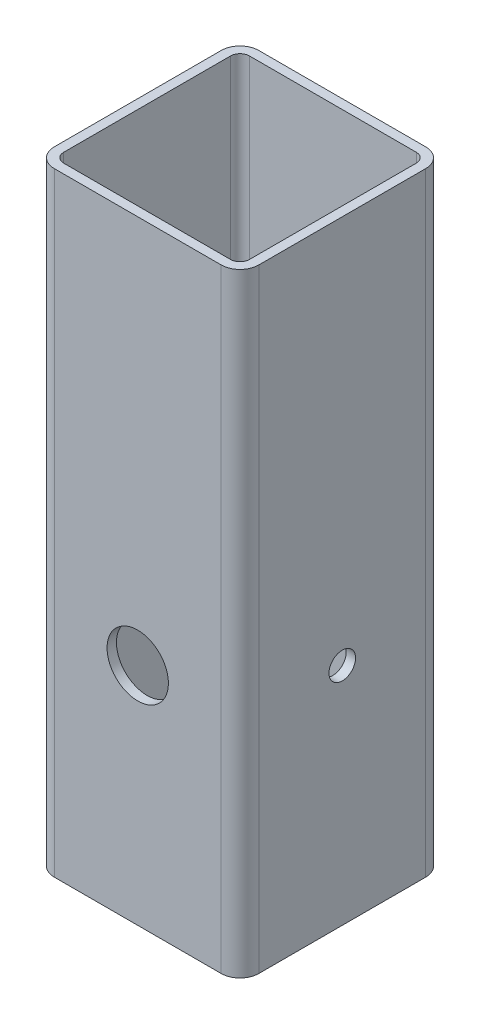
from build123d import *

# Parameters (mm, degrees)
SHS_C450_AS_50X50X2_3_SHS_C450_1_DEPTH = 150
SKETCH12_R                             = 3.25
CUT_EXTRUDE1_DEPTH                     = 10
SKETCH13_R                             = 3.25
CUT_EXTRUDE2_DEPTH                     = 10
SKETCH14_R                             = 7.5
CUT_EXTRUDE3_DEPTH                     = 10
SKETCH15_R                             = 7.5
CUT_EXTRUDE4_DEPTH                     = 10


with BuildPart() as part:
    # Sketch11 → Shs c450 as 50X50X2.3 SHS C450(1) (new body)
    with BuildSketch(Plane.ZX.offset(-75)):
        with BuildLine():
            Line((-20.4, -25), (20.4, -25))
            ThreePointArc((20.4, -25), (23.652691193, -23.652691193), (25, -20.4))
            Line((25, -20.4), (25, 20.4))
            ThreePointArc((25, 20.4), (23.652691193, 23.652691193), (20.4, 25))
            Line((20.4, 25), (-20.4, 25))
            ThreePointArc((-20.4, 25), (-23.652691193, 23.652691193), (-25, 20.4))
            Line((-25, 20.4), (-25, -20.4))
            ThreePointArc((-25, -20.4), (-23.652691193, -23.652691193), (-20.4, -25))
        make_face()
        with BuildLine():
            Line((-20.4, 22.7), (20.4, 22.7))
            ThreePointArc((20.4, 22.7), (22.026345597, 22.026345597), (22.7, 20.4))
            Line((22.7, 20.4), (22.7, -20.4))
            ThreePointArc((22.7, -20.4), (22.026345597, -22.026345597), (20.4, -22.7))
            Line((20.4, -22.7), (-20.4, -22.7))
            ThreePointArc((-20.4, -22.7), (-22.026345597, -22.026345597), (-22.7, -20.4))
            Line((-22.7, -20.4), (-22.7, 20.4))
            ThreePointArc((-22.7, 20.4), (-22.026345597, 22.026345597), (-20.4, 22.7))
        make_face(mode=Mode.SUBTRACT)
    extrude(amount=SHS_C450_AS_50X50X2_3_SHS_C450_1_DEPTH)

    # Sketch12 → Cut-Extrude1 (cut)
    with BuildSketch(Plane(origin=(25, 0, 0), x_dir=(0, 0, -1), z_dir=(1, 0, 0))):
        with Locations((0, -20)):
            Circle(SKETCH12_R)
    extrude(amount=-CUT_EXTRUDE1_DEPTH, mode=Mode.SUBTRACT)

    # Sketch13 → Cut-Extrude2 (cut)
    with BuildSketch(Plane(origin=(0, 0, -25), x_dir=(-1, 0, 0), z_dir=(0, 0, -1))):
        with Locations((0, -20)):
            Circle(SKETCH13_R)
    extrude(amount=-CUT_EXTRUDE2_DEPTH, mode=Mode.SUBTRACT)

    # Sketch14 → Cut-Extrude3 (cut)
    with BuildSketch(Plane.XY.offset(25)):
        with Locations((0, -20)):
            Circle(SKETCH14_R)
    extrude(amount=-CUT_EXTRUDE3_DEPTH, mode=Mode.SUBTRACT)

    # Sketch15 → Cut-Extrude4 (cut)
    with BuildSketch(Plane.ZY.offset(25)):
        with Locations((0, -20)):
            Circle(SKETCH15_R)
    extrude(amount=-CUT_EXTRUDE4_DEPTH, mode=Mode.SUBTRACT)


solid = part.part
